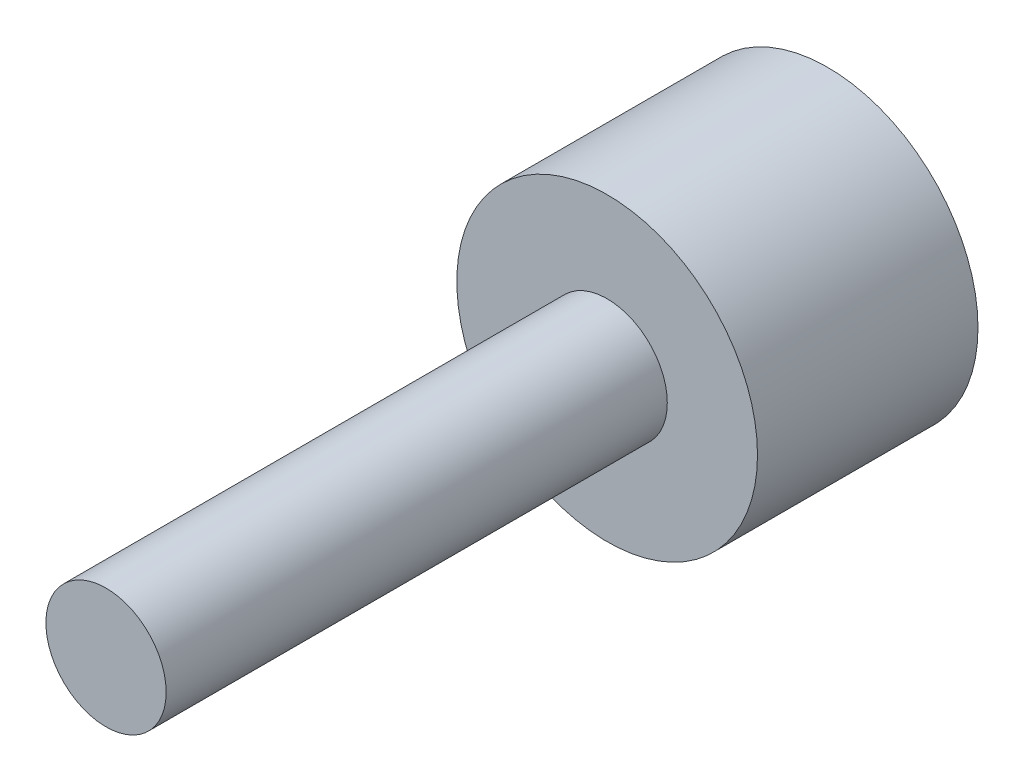
from build123d import *

# Parameters (mm, degrees)
SKETCH_1_R      = 7.5
EXTRUDE_1_DEPTH = 5.5
SKETCH_2_R      = 3
EXTRUDE_2_DEPTH = 25


with BuildPart() as part:
    # 草图1 → 凸台-拉伸1 (new, symmetric)
    with BuildSketch(Plane.XY):
        Circle(SKETCH_1_R)
    extrude(amount=EXTRUDE_1_DEPTH, both=True)

    # 草图2 → 凸台-拉伸2 (add)
    with BuildSketch(Plane.XY.offset(5.5)):
        Circle(SKETCH_2_R)
    extrude(amount=EXTRUDE_2_DEPTH)


solid = part.part
